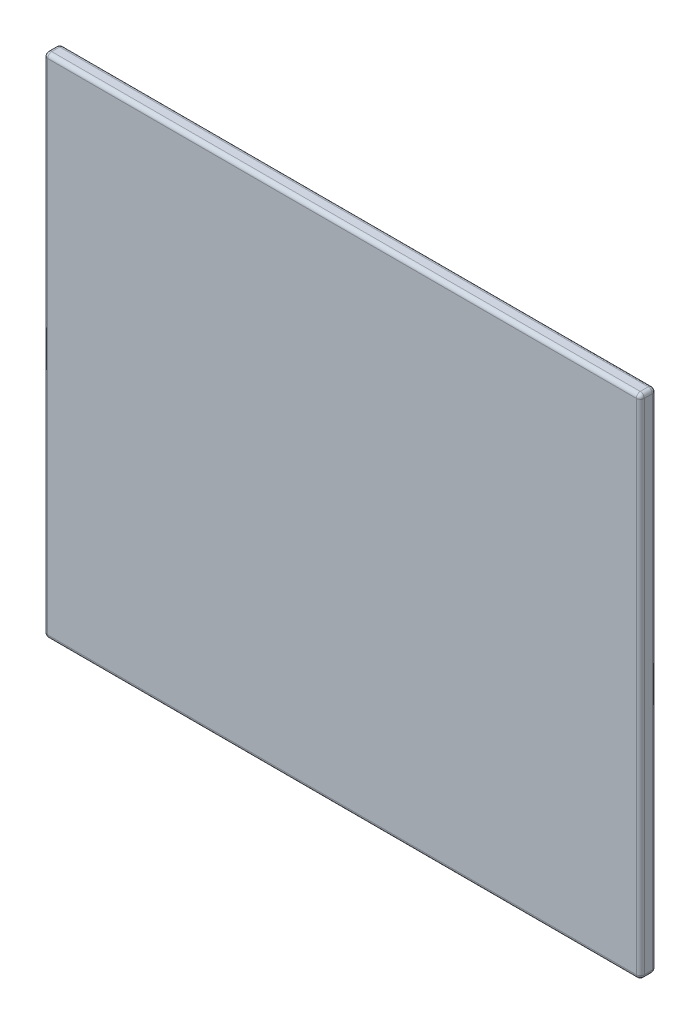
from build123d import *

# Parameters (mm, degrees)
SKETCH1_W           = 74.7
SKETCH1_H           = 63.5
BOSS_EXTRUDE1_DEPTH = 2
FILLET1_R           = 0.5


with BuildPart() as part:
    # Sketch1 → Boss-Extrude1 (new body)
    with BuildSketch(Plane.XY):
        Rectangle(SKETCH1_W, SKETCH1_H)
    extrude(amount=BOSS_EXTRUDE1_DEPTH)

    # Fillet1
    fillet1_edges = [part.edges().sort_by_distance(p)[0] for p in [
        (-37.35, 0, 2),
        (0, -31.75, 2),
        (37.35, 0, 2),
        (0, -31.75, 0),
        (-37.35, 0, 0),
        (0, 31.75, 0),
        (37.35, 0, 0),
        (37.35, -31.75, 1),
        (-37.35, -31.75, 1),
        (-37.35, 31.75, 1),
        (37.35, 31.75, 1),
        (0, 31.75, 2),
    ]]
    fillet(fillet1_edges, radius=FILLET1_R)


solid = part.part
